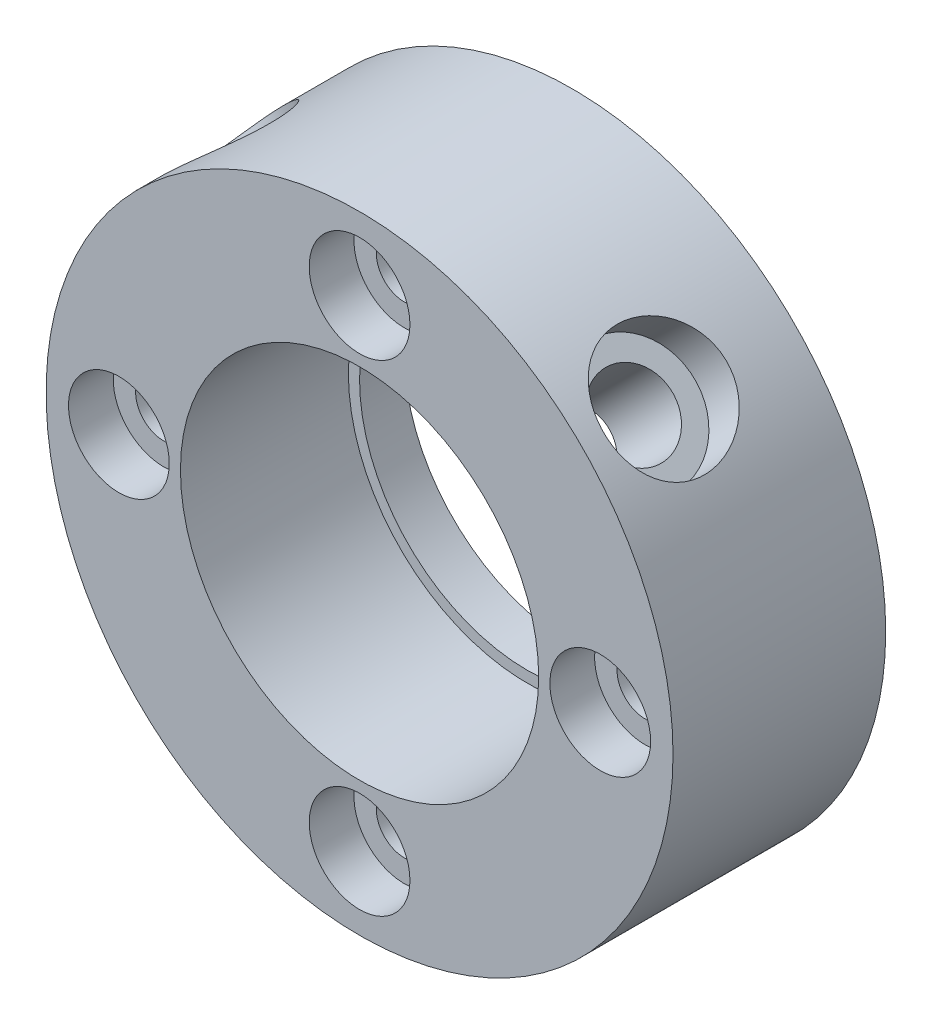
from build123d import *

# Parameters (mm, degrees)
SKETCH1_R           = 14
BOSS_EXTRUDE1_DEPTH = 2
SKETCH2_R           = 14
SKETCH2_R_2         = 8
BOSS_EXTRUDE2_DEPTH = 7.5
SKETCH3_R           = 7.5
CUT_EXTRUDE1_DEPTH  = 2
SKETCH5_R           = 1.25
CUT_EXTRUDE2_DEPTH  = 22.960191256
SKETCH7_R           = 1.75
CUT_EXTRUDE3_DEPTH  = 7
SKETCH9_R           = 1.75
CUT_EXTRUDE4_DEPTH  = 7
SKETCH10_R          = 2.25
CUT_EXTRUDE5_DEPTH  = 2
SKETCH11_R          = 2.75
CUT_EXTRUDE6_DEPTH  = 2
SKETCH12_R          = 2.75
CUT_EXTRUDE7_DEPTH  = 2


with BuildPart() as part:
    # Sketch1 → Boss-Extrude1 (new body)
    with BuildSketch(Plane.XY):
        Circle(SKETCH1_R)
    extrude(amount=BOSS_EXTRUDE1_DEPTH)

    # Sketch2 → Boss-Extrude2 (add)
    with BuildSketch(Plane.XY.offset(2)):
        Circle(SKETCH2_R)
        Circle(SKETCH2_R_2, mode=Mode.SUBTRACT)
    extrude(amount=BOSS_EXTRUDE2_DEPTH)

    # Sketch3 → Cut-Extrude1 (cut)
    with BuildSketch(Plane(origin=(0, 0, 0), x_dir=(-1, 0, 0), z_dir=(0, 0, -1))):
        Circle(SKETCH3_R)
    extrude(amount=-CUT_EXTRUDE1_DEPTH, mode=Mode.SUBTRACT)

    # Sketch5 → Cut-Extrude2 (cut, through all)
    with BuildSketch(Plane.XY.offset(9.5)):
        with Locations((0, 10.75)):
            Circle(SKETCH5_R)
        with Locations((10.75, 0)):
            Circle(SKETCH5_R)
        with Locations((0, -10.75)):
            Circle(SKETCH5_R)
        with Locations((-10.75, 0)):
            Circle(SKETCH5_R)
    extrude(amount=-CUT_EXTRUDE2_DEPTH, mode=Mode.SUBTRACT)

    # Sketch7 → Cut-Extrude3 (cut)
    with BuildSketch(Plane(origin=(9.899494937, 9.899494937, 0), x_dir=(0.7071067811865489, -0.7071067811865461, 0), z_dir=(0.7071067811865461, 0.7071067811865489, 0))):
        with Locations((0, -5.75)):
            Circle(SKETCH7_R)
    extrude(amount=-CUT_EXTRUDE3_DEPTH, mode=Mode.SUBTRACT)

    # Sketch9 → Cut-Extrude4 (cut)
    with BuildSketch(Plane(origin=(-9.899494937, 9.899494937, 0), x_dir=(0, 0, 1), z_dir=(-0.7071067811865489, 0.7071067811865462, 0))):
        with Locations((5.75, 0)):
            Circle(SKETCH9_R)
    extrude(amount=-CUT_EXTRUDE4_DEPTH, mode=Mode.SUBTRACT)

    # Sketch10 → Cut-Extrude5 (cut)
    with BuildSketch(Plane.XY.offset(9.5)):
        with Locations((0, 10.75)):
            Circle(SKETCH10_R)
        with Locations((10.75, 0)):
            Circle(SKETCH10_R)
        with Locations((0, -10.75)):
            Circle(SKETCH10_R)
        with Locations((-10.75, 0)):
            Circle(SKETCH10_R)
    extrude(amount=-CUT_EXTRUDE5_DEPTH, mode=Mode.SUBTRACT)

    # Sketch11 → Cut-Extrude6 (cut)
    with BuildSketch(Plane(origin=(9.899494937, 9.899494937, 0), x_dir=(0.7071067811865489, -0.7071067811865461, 0), z_dir=(0.7071067811865461, 0.7071067811865489, 0))):
        with Locations((0, -5.75)):
            Circle(SKETCH11_R)
    extrude(amount=-CUT_EXTRUDE6_DEPTH, mode=Mode.SUBTRACT)

    # Sketch12 → Cut-Extrude7 (cut)
    with BuildSketch(Plane(origin=(-9.899494937, 9.899494937, 0), x_dir=(0, 0, 1), z_dir=(-0.7071067811865489, 0.7071067811865462, 0))):
        with Locations((5.75, 0)):
            Circle(SKETCH12_R)
    extrude(amount=-CUT_EXTRUDE7_DEPTH, mode=Mode.SUBTRACT)


solid = part.part
